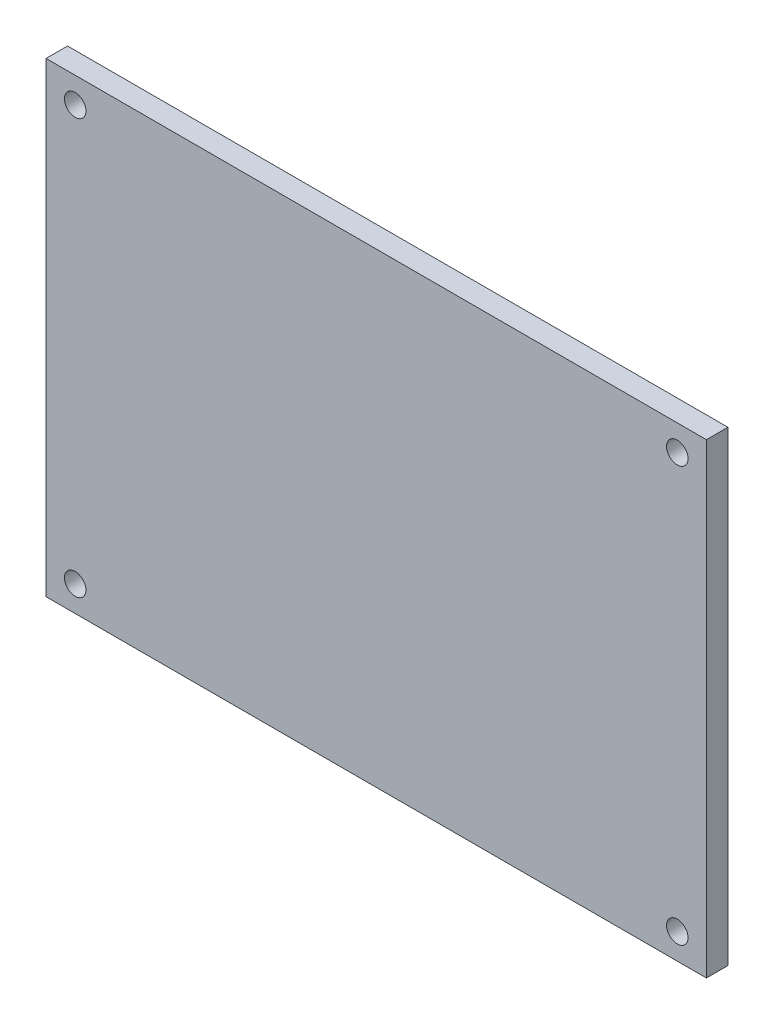
from build123d import *

# Parameters (mm, degrees)
SKETCH_1_W      = 92.075
SKETCH_1_H      = 65
SKETCH_1_R      = 1.5
EXTRUDE_1_DEPTH = 3


with BuildPart() as part:
    # 草图1 → 凸台-拉伸1 (new body)
    with BuildSketch(Plane.XY):
        Rectangle(SKETCH_1_W, SKETCH_1_H)
        with Locations((-41.9735, 28.92)):
            Circle(SKETCH_1_R, mode=Mode.SUBTRACT)
        with Locations((41.9735, 28.92)):
            Circle(SKETCH_1_R, mode=Mode.SUBTRACT)
        with Locations((41.9735, -28.92)):
            Circle(SKETCH_1_R, mode=Mode.SUBTRACT)
        with Locations((-41.9735, -28.92)):
            Circle(SKETCH_1_R, mode=Mode.SUBTRACT)
    extrude(amount=EXTRUDE_1_DEPTH)


solid = part.part
